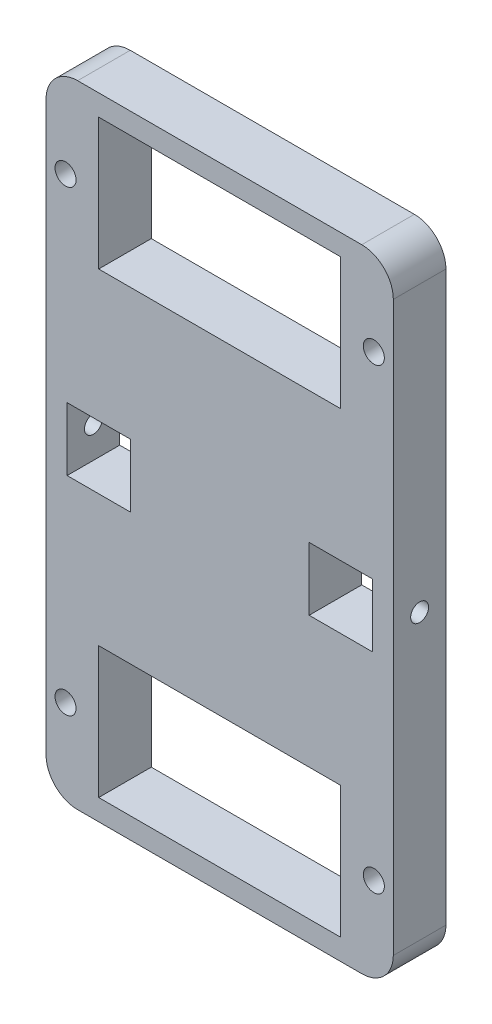
from build123d import *

# Parameters (mm, degrees)
SKETCH1_W           = 33
SKETCH1_H           = 60
SKETCH1_R           = 1
SKETCH1_W_2         = 23
SKETCH1_H_2         = 12.5
SKETCH1_W_3         = 6
SKETCH1_H_3         = 6
BOSS_EXTRUDE1_DEPTH = 5
SKETCH2_R           = 0.85
CUT_EXTRUDE1_DEPTH  = 3
CUT_EXTRUDE2_START  = -3
SKETCH3_R           = 0.85
CUT_EXTRUDE2_DEPTH  = 3
FILLET1_R           = 3


with BuildPart() as part:
    # Sketch1 → Boss-Extrude1 (new body)
    with BuildSketch(Plane.XY):
        Rectangle(SKETCH1_W, SKETCH1_H)
        with Locations((-14.65, 21.75)):
            Circle(SKETCH1_R, mode=Mode.SUBTRACT)
        with Locations(Location((14.65, 21.75, 0), (0, 0, 180))):
            Circle(SKETCH1_R, mode=Mode.SUBTRACT)
        with Locations((14.65, -21.75)):
            Circle(SKETCH1_R, mode=Mode.SUBTRACT)
        with Locations(Location((-14.65, -21.75, 0), (0, 0, 180))):
            Circle(SKETCH1_R, mode=Mode.SUBTRACT)
        with Locations((0, 21.75)):
            Rectangle(SKETCH1_W_2, SKETCH1_H_2, mode=Mode.SUBTRACT)
        with Locations((0, -21.75)):
            Rectangle(SKETCH1_W_2, SKETCH1_H_2, mode=Mode.SUBTRACT)
        with Locations((11.5, 0)):
            Rectangle(SKETCH1_W_3, SKETCH1_H_3, mode=Mode.SUBTRACT)
        with Locations((-11.5, 0)):
            Rectangle(SKETCH1_W_3, SKETCH1_H_3, mode=Mode.SUBTRACT)
    extrude(amount=BOSS_EXTRUDE1_DEPTH)

    # Sketch2 → Cut-Extrude1 (cut)
    with BuildSketch(Plane(origin=(16.5, 0, 0), x_dir=(0, 0, -1), z_dir=(1, 0, 0))):
        with Locations((-2.5, 0)):
            Circle(SKETCH2_R)
    extrude(amount=-CUT_EXTRUDE1_DEPTH, mode=Mode.SUBTRACT)

    # Sketch3 → Cut-Extrude2 (cut)
    with BuildSketch(Plane.ZY.offset(16.5).offset(CUT_EXTRUDE2_START)):
        with Locations(Location((2.5, 0, 0), (0, 0, 180))):
            Circle(SKETCH3_R)
    extrude(amount=CUT_EXTRUDE2_DEPTH, mode=Mode.SUBTRACT)

    # Fillet1
    fillet1_edges = [part.edges().sort_by_distance(p)[0] for p in [
        (16.5, -30, 2.5),
        (-16.5, -30, 2.5),
        (-16.5, 30, 2.5),
        (16.5, 30, 2.5),
    ]]
    fillet(fillet1_edges, radius=FILLET1_R)


solid = part.part
